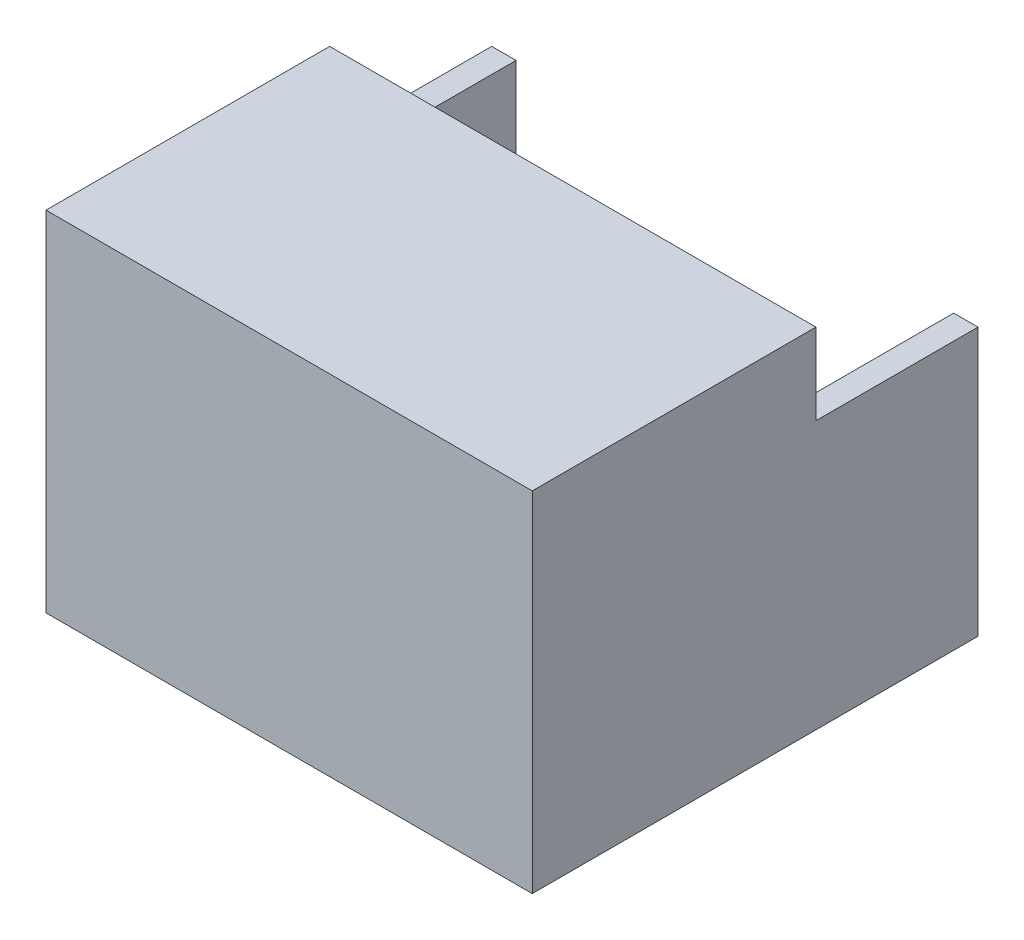
from build123d import *

# Parameters (mm, degrees)
IZIM1_W                     = 60
IZIM1_H                     = 43.037715622
IZIM1_W_2                   = 54
IZIM1_H_2                   = 37.037715622
Y_KSEKLIK_EKSTR_ZYON1_DEPTH = 110
IZIM2_W                     = 60
IZIM2_H                     = 20
KES_EKSTR_ZYON1_DEPTH       = 10
IZIM3_W                     = 60
IZIM3_H                     = 43.037715622
Y_KSEKLIK_EKSTR_ZYON2_DEPTH = 10
IZIM4_W                     = 60
IZIM4_H                     = 55
KES_EKSTR_ZYON2_DEPTH       = 70
IZIM5_W                     = 60
IZIM5_H                     = 43.037715622
Y_KSEKLIK_EKSTR_ZYON3_DEPTH = 5


with BuildPart() as part:
    # Çizim1 → Yükseklik-Ekstrüzyon1 (new body)
    with BuildSketch(Plane.XY):
        with Locations((30, 21.518857811)):
            Rectangle(IZIM1_W, IZIM1_H)
        with Locations((30, 21.518857811)):
            Rectangle(IZIM1_W_2, IZIM1_H_2, mode=Mode.SUBTRACT)
    extrude(amount=Y_KSEKLIK_EKSTR_ZYON1_DEPTH)

    # Çizim2 → Kes-Ekstrüzyon1 (cut)
    with BuildSketch(Plane(origin=(0, 43.037715622, 0), x_dir=(1, 0, 0), z_dir=(0, 1, 0))):
        with Locations((30, -10)):
            Rectangle(IZIM2_W, IZIM2_H)
    extrude(amount=-KES_EKSTR_ZYON1_DEPTH, mode=Mode.SUBTRACT)

    # Çizim3 → Yükseklik-Ekstrüzyon2 (add)
    with BuildSketch(Plane.XY.offset(110)):
        with Locations((30, 21.518857811)):
            Rectangle(IZIM3_W, IZIM3_H)
    extrude(amount=-Y_KSEKLIK_EKSTR_ZYON2_DEPTH)

    # Çizim4 → Kes-Ekstrüzyon2 (cut)
    with BuildSketch(Plane(origin=(0, 43.037715622, 0), x_dir=(1, 0, 0), z_dir=(0, 1, 0))):
        with Locations((30, -82.5)):
            Rectangle(IZIM4_W, IZIM4_H)
    extrude(amount=-KES_EKSTR_ZYON2_DEPTH, mode=Mode.SUBTRACT)

    # Çizim5 → Yükseklik-Ekstrüzyon3 (add)
    with BuildSketch(Plane.XY.offset(55)):
        with Locations((30, 21.518857811)):
            Rectangle(IZIM5_W, IZIM5_H)
    extrude(amount=-Y_KSEKLIK_EKSTR_ZYON3_DEPTH)


solid = part.part
